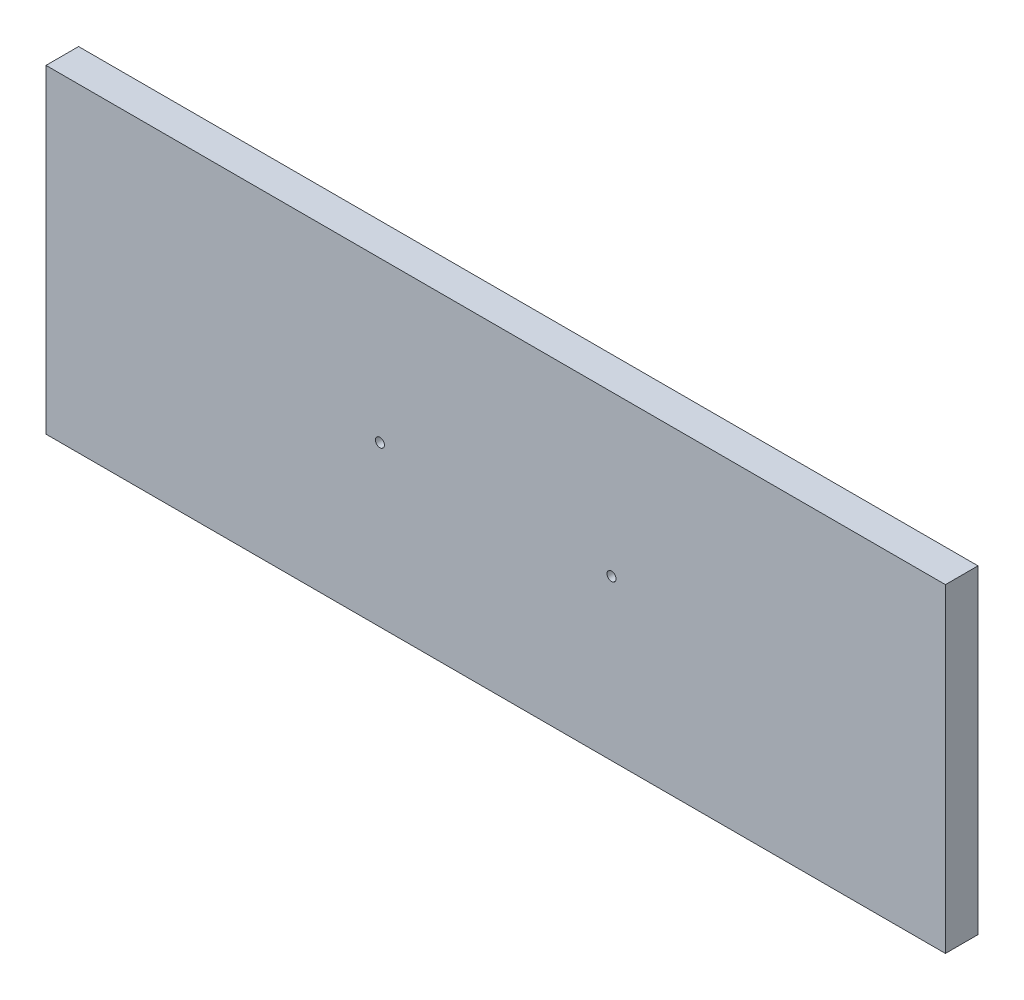
from build123d import *

# Parameters (mm, degrees)
SKETCH1_W           = 497
SKETCH1_H           = 176.5
BOSS_EXTRUDE1_DEPTH = 18
SKETCH5_R           = 2.5
CUT_EXTRUDE4_DEPTH  = 18
SKETCH6_R           = 5
CUT_EXTRUDE5_DEPTH  = 12


with BuildPart() as part:
    # Sketch1 → Boss-Extrude1 (new body)
    with BuildSketch(Plane.XY):
        with Locations((0, -302.75)):
            Rectangle(SKETCH1_W, SKETCH1_H)
    extrude(amount=BOSS_EXTRUDE1_DEPTH)

    # Sketch5 → Cut-Extrude4 (cut)
    with BuildSketch(Plane.XY.offset(18)):
        with Locations((64, -302.75)):
            Circle(SKETCH5_R)
        with Locations(Location((-64, -302.75, 0), (0, 0, 180))):
            Circle(SKETCH5_R)
    extrude(amount=-CUT_EXTRUDE4_DEPTH, mode=Mode.SUBTRACT)

    # Sketch6 → Cut-Extrude5 (cut)
    with BuildSketch(Plane(origin=(0, 0, 0), x_dir=(-1, 0, 0), z_dir=(0, 0, -1))):
        with Locations((224, -270.5)):
            Circle(SKETCH6_R)
        with Locations(Location((-224, -270.5, 0), (0, 0, 180))):
            Circle(SKETCH6_R)
        with Locations((224, -334.5)):
            Circle(SKETCH6_R)
        with Locations(Location((-224, -334.5, 0), (0, 0, 180))):
            Circle(SKETCH6_R)
    extrude(amount=-CUT_EXTRUDE5_DEPTH, mode=Mode.SUBTRACT)


solid = part.part
